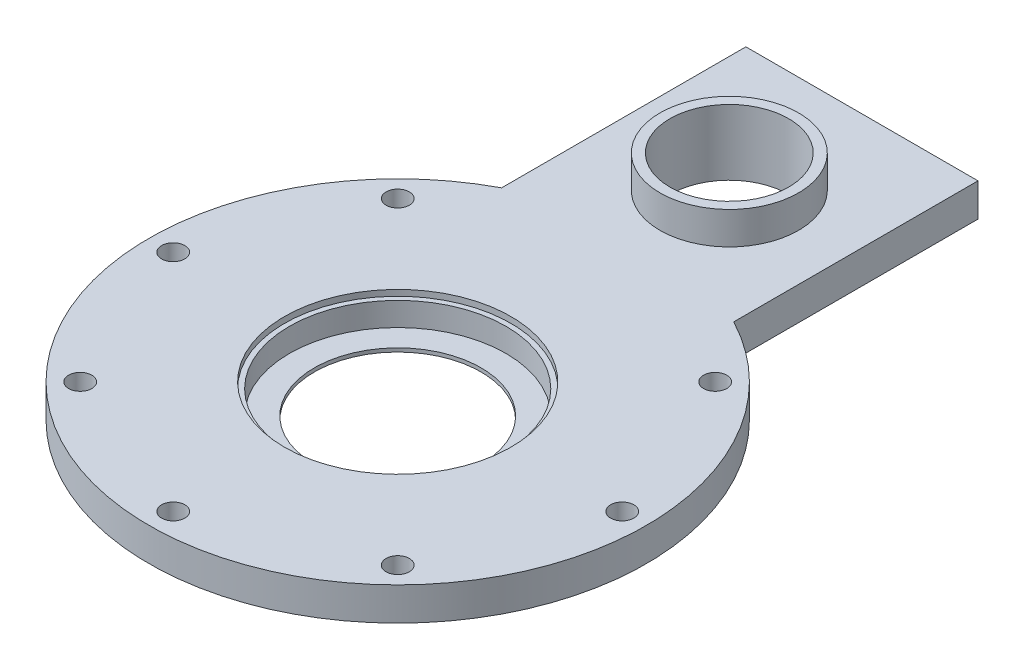
from build123d import *

# Parameters (mm, degrees)
EXTRUDE_1_DEPTH     = 10
SKETCH_2_R          = 17.9
SKETCH_2_R_2        = 25.15
CUT_EXTRUDE_1_DEPTH = 178.623196683
SKETCH_4_R          = 34.15
CUT_EXTRUDE_2_DEPTH = 1.8
SKETCH_5_R          = 32.65
CUT_EXTRUDE_3_DEPTH = 7.1
EXTRUDE_START       = 9.8
SKETCH_6_R          = 20.9
SKETCH_6_R_2        = 17.9
EXTRUDE_2_DEPTH     = 9.8
EXTRUDE_START_2     = -10
EXTRUDE_3_DEPTH     = 10
CUT_EXTRUDE_4_DEPTH = 192.421106464
SKETCH_11_R         = 3.5
CUT_EXTRUDE_5_DEPTH = 191.656759649
CUT_EXTRUDE_6_DEPTH = 191.656759649


with BuildPart() as part:
    # 草图1 → 凸台-拉伸1 (new body)
    with BuildSketch(Plane(origin=(0, 0, 0), x_dir=(1, 0, 0), z_dir=(0, 1, 0))):
        with BuildLine():
            Line((63.686733312, -87), (44.09081537, 9))
            ThreePointArc((44.09081537, 9), (0, 45), (-44.09081537, 9))
            Line((-44.09081537, 9), (-63.686733312, -87))
            ThreePointArc((-63.686733312, -87), (0, -165), (63.686733312, -87))
        make_face()
    extrude(amount=EXTRUDE_1_DEPTH)

    # 草图2 → 切除-拉伸1 (cut, through all)
    with BuildSketch(Plane(origin=(0, 10, 0), x_dir=(1, 0, 0), z_dir=(0, 1, 0))):
        with Locations(Location((0, 0, 0), (0, 0, 270))):
            Circle(SKETCH_2_R)
        with Locations(Location((0, -100, 0), (0, 0, 270))):
            Circle(SKETCH_2_R_2)
    extrude(amount=-CUT_EXTRUDE_1_DEPTH, mode=Mode.SUBTRACT)

    # 草图4 → 切除-拉伸2 (cut)
    with BuildSketch(Plane(origin=(0, 10, 0), x_dir=(1, 0, 0), z_dir=(0, 1, 0))):
        with Locations(Location((0, -100, 0), (0, 0, 270))):
            Circle(SKETCH_4_R)
    extrude(amount=-CUT_EXTRUDE_2_DEPTH, mode=Mode.SUBTRACT)

    # 草图5 → 切除-拉伸3 (cut)
    with BuildSketch(Plane(origin=(0, 8.2, 0), x_dir=(1, 0, 0), z_dir=(0, 1, 0))):
        with Locations(Location((0, -100, 0), (0, 0, 270))):
            Circle(SKETCH_5_R)
    extrude(amount=-CUT_EXTRUDE_3_DEPTH, mode=Mode.SUBTRACT)

    # 草图6 → 凸台-拉伸2 (add)
    with BuildSketch(Plane(origin=(0, 10, 0), x_dir=(1, 0, 0), z_dir=(0, 1, 0)).offset(EXTRUDE_START)):
        with Locations(Location((0, 0, 0), (0, 0, 270))):
            Circle(SKETCH_6_R)
        with Locations(Location((0, 0, 0), (0, 0, 270))):
            Circle(SKETCH_6_R_2, mode=Mode.SUBTRACT)
    extrude(amount=-EXTRUDE_2_DEPTH)

    # 草图7 → 凸台-拉伸3 (add)
    with BuildSketch(Plane.XZ.offset(EXTRUDE_START_2)):
        with BuildLine():
            Line((-44.09081537, -9), (-45, -4.54592315))
            Line((-45, -4.54592315), (-45, -40))
            Line((-45, -40), (-20.615528128, -40))
            ThreePointArc((-20.615528128, -40), (-35.874471734, -27.166565439), (-44.09081537, -9))
        make_face()
        with BuildLine():
            ThreePointArc((56.203418539, 50.33939444), (0, 175), (-56.203418539, 50.33939444))
            Line((-56.203418539, 50.33939444), (-63.686733312, 87))
            ThreePointArc((-63.686733312, 87), (0, 165), (63.686733312, 87))
            Line((63.686733312, 87), (56.203418539, 50.33939444))
        make_face()
        with BuildLine():
            Line((45, -40), (45, -4.54592315))
            Line((45, -4.54592315), (44.09081537, -9))
            ThreePointArc((44.09081537, -9), (35.874471734, -27.166565439), (20.615528128, -40))
            Line((20.615528128, -40), (45, -40))
        make_face()
    extrude(amount=EXTRUDE_3_DEPTH)

    # 草图8 → 切除-拉伸4 (cut, through all)
    with BuildSketch(Plane.XZ):
        with BuildLine():
            Line((-45, -4.54592315), (-45, 40))
            ThreePointArc((-45, 40), (-50.865103463, 44.884292169), (-56.203418539, 50.33939444))
            Line((-56.203418539, 50.33939444), (-45, -4.54592315))
        make_face()
        with BuildLine():
            ThreePointArc((56.203418539, 50.33939444), (50.865103463, 44.884292169), (45, 40))
            Line((45, 40), (45, -4.54592315))
            Line((45, -4.54592315), (56.203418539, 50.33939444))
        make_face()
        with BuildLine():
            Line((20.615528128, -40), (-20.615528128, -40))
            ThreePointArc((-20.615528128, -40), (0, -45), (20.615528128, -40))
        make_face()
    extrude(amount=-CUT_EXTRUDE_4_DEPTH, mode=Mode.SUBTRACT)

    # 草图11 → 切除-拉伸5 (cut, through all)
    with BuildSketch(Plane(origin=(0, 10, 0), x_dir=(1, 0, 0), z_dir=(0, 1, 0))):
        with Locations(Location((0, -167.7, 0), (0, 0, 270))):
            Circle(SKETCH_11_R)
        with Locations(Location((47.871129086, -147.871129086, 0), (0, 0, 270))):
            Circle(SKETCH_11_R)
        with Locations(Location((-47.871129086, -147.871129086, 0), (0, 0, 270))):
            Circle(SKETCH_11_R)
        with Locations(Location((-67.7, -100, 0), (0, 0, 270))):
            Circle(SKETCH_11_R)
        with Locations(Location((-47.871129086, -52.128870914, 0), (0, 0, 270))):
            Circle(SKETCH_11_R)
        with Locations(Location((67.7, -100, 0), (0, 0, 270))):
            Circle(SKETCH_11_R)
        with Locations(Location((47.871129086, -52.128870914, 0), (0, 0, 270))):
            Circle(SKETCH_11_R)
    extrude(amount=-CUT_EXTRUDE_5_DEPTH, mode=Mode.SUBTRACT)

    # 草图12 → 切除-拉伸6 (cut, through all)
    with BuildSketch(Plane(origin=(0, 10, 0), x_dir=(1, 0, 0), z_dir=(0, 1, 0))):
        with BuildLine():
            ThreePointArc((-45, -40), (-40.12511839, -36.636170616), (-35, -33.667504193))
            Line((-35, -33.667504193), (-35, 40))
            Line((-35, 40), (-45, 40))
            Line((-45, 40), (-45, -40))
        make_face()
        with BuildLine():
            Line((35, 40), (35, -33.667504193))
            ThreePointArc((35, -33.667504193), (40.12511839, -36.636170616), (45, -40))
            Line((45, -40), (45, 40))
            Line((45, 40), (35, 40))
        make_face()
    extrude(amount=-CUT_EXTRUDE_6_DEPTH, mode=Mode.SUBTRACT)


solid = part.part
